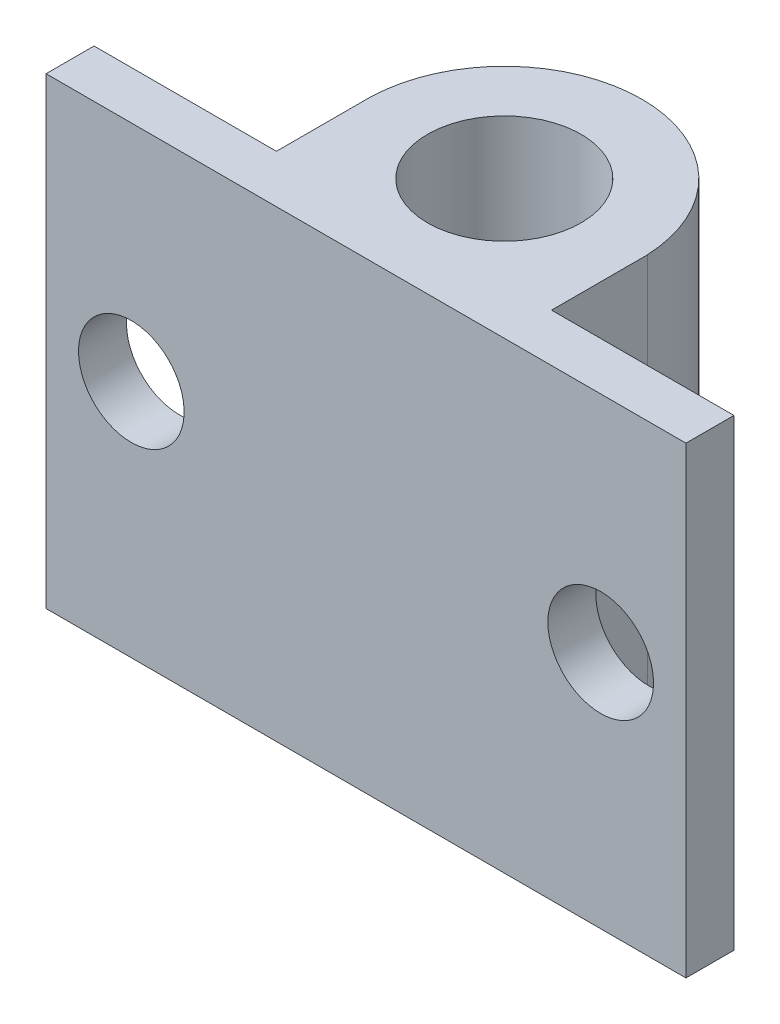
from build123d import *

# Parameters (mm, degrees)
SKETCH1_R           = 4.3
SKETCH1_R_2         = 2.4
SKETCH1_W           = 20
SKETCH1_H           = 1.5
BOSS_EXTRUDE1_DEPTH = 14.478
SKETCH2_W           = 1.056255113
SKETCH2_H           = 14.478
BOSS_EXTRUDE2_DEPTH = 3
SKETCH3_W           = 1.056255113
SKETCH3_H           = 14.478
BOSS_EXTRUDE3_DEPTH = 3
SKETCH4_R           = 1.651
CUT_EXTRUDE1_DEPTH  = 3


with BuildPart() as part:
    # Sketch1 → Boss-Extrude1 (new body)
    # profile 1 of 2: a face of its own
    with BuildSketch(Plane(origin=(0, 0, 0), x_dir=(1, 0, 0), z_dir=(0, 1, 0))):
        Circle(SKETCH1_R)
        with Locations(Location((0, 0, 0), (0, 0, 270))):
            Circle(SKETCH1_R_2, mode=Mode.SUBTRACT)
    # profile 2 of 2: a face of its own
    with BuildSketch(Plane(origin=(0, 0, 0), x_dir=(1, 0, 0), z_dir=(0, 1, 0))):
        with Locations((0, -3.572785701)):
            Rectangle(SKETCH1_W, SKETCH1_H)
    extrude(amount=BOSS_EXTRUDE1_DEPTH)

    # Sketch2 → Boss-Extrude2 (add)
    with BuildSketch(Plane(origin=(0, 0, 2.822785701), x_dir=(-1, 0, 0), z_dir=(0, 0, -1))):
        with Locations((-3.771872444, 7.239)):
            Rectangle(SKETCH2_W, SKETCH2_H)
    extrude(amount=BOSS_EXTRUDE2_DEPTH)

    # Sketch3 → Boss-Extrude3 (add)
    with BuildSketch(Plane(origin=(0, 0, 2.822785701), x_dir=(-1, 0, 0), z_dir=(0, 0, -1))):
        with Locations((3.771872444, 7.239)):
            Rectangle(SKETCH3_W, SKETCH3_H)
    extrude(amount=BOSS_EXTRUDE3_DEPTH)

    # Sketch4 → Cut-Extrude1 (cut)
    with BuildSketch(Plane(origin=(0, 0, 2.822785701), x_dir=(-1, 0, 0), z_dir=(0, 0, -1))):
        with Locations((-7.335568172, 7.478)):
            Circle(SKETCH4_R)
        with Locations((7.335568172, 7.478)):
            Circle(SKETCH4_R)
    extrude(amount=-CUT_EXTRUDE1_DEPTH, mode=Mode.SUBTRACT)


solid = part.part
